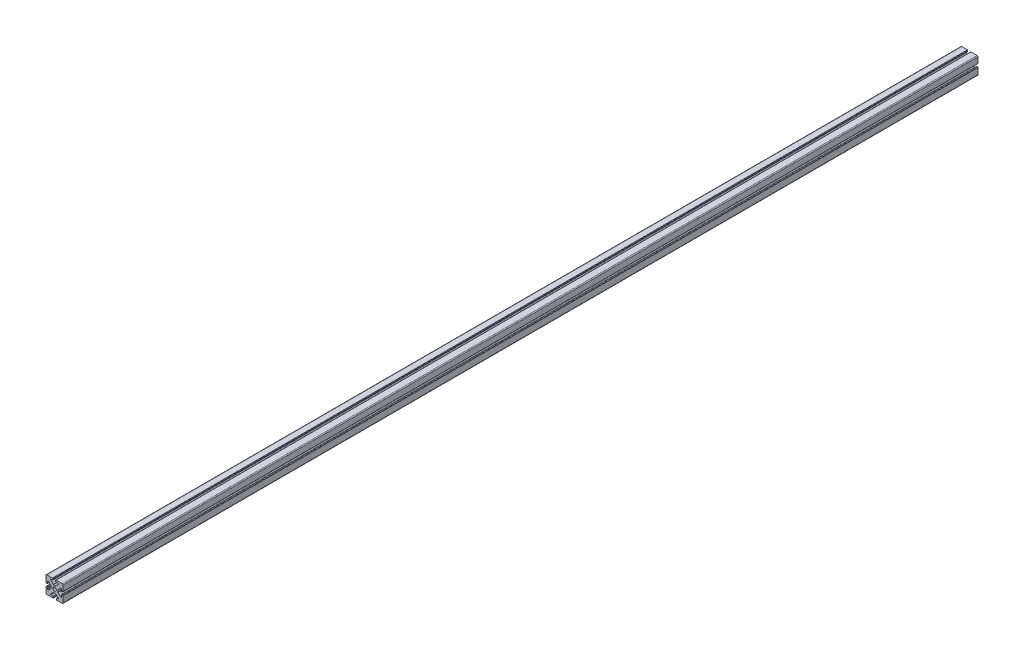
from build123d import *

# Parameters (mm, degrees)
SKETCH_1_W               = 40
SKETCH_1_H               = 40
EXTRUDE_1_DEPTH          = 2140
SKETCH_2_R               = 4.05
CUT_EXTRUDE_1_DEPTH      = 10000
CUT_EXTRUDE_2_DEPTH      = 10000
FILLET_1_R               = 1
PATTERN_CIRCULAR_2_COUNT = 4
FILLET_2_R               = 1
FILLET_3_R               = 1
FILLET_4_R               = 1
FILLET_5_R               = 2


with BuildPart() as part:
    # 草图1 → 凸台-拉伸1 (new body)
    with BuildSketch(Plane.XY):
        Rectangle(SKETCH_1_W, SKETCH_1_H)
    extrude(amount=EXTRUDE_1_DEPTH)

    # 草图2 → 切除-拉伸1 (cut)
    with BuildSketch(Plane.XY.offset(2140)):
        Circle(SKETCH_2_R)
    extrude(amount=-CUT_EXTRUDE_1_DEPTH, mode=Mode.SUBTRACT)

    # 草图4 → 切除-拉伸2 (cut)
    with BuildSketch(Plane.XY.offset(2140)):
        Polygon((20, 0), (20, 4), (16, 4), (16, 10.5), (7.876860985, 2.6), (7.876860985, -2.6), (16, -10.5), (16, -2.65197969), (20, -2.65197969), align=None)
    cut_extrude_2 = extrude(amount=-CUT_EXTRUDE_2_DEPTH, mode=Mode.SUBTRACT)

    # 圆角1
    fillet_1_edges = [part.edges().sort_by_distance(p)[0] for p in [
        (20, -2.65197969, 1070),
        (16, -2.65197969, 1070),
        (16, -10.5, 1070),
        (7.876860985, -2.6, 1070),
        (7.876860985, 2.6, 1070),
        (16, 10.5, 1070),
        (16, 4, 1070),
        (20, 4, 1070),
    ]]
    fillet(fillet_1_edges, radius=FILLET_1_R)

    # 阵列(圆周)2: 切除-拉伸2 ×4 about axis
    pattern_circular_2_axis = Axis((0, 0, 0), (0, 0, 1))
    for i in range(1, PATTERN_CIRCULAR_2_COUNT):
        add(cut_extrude_2.rotate(pattern_circular_2_axis, i * 360 / PATTERN_CIRCULAR_2_COUNT), mode=Mode.SUBTRACT)

    # 圆角2
    fillet_2_edges = [part.edges().sort_by_distance(p)[0] for p in [
        (2.65197969, 20, 1070),
        (2.65197969, 16, 1070),
        (10.5, 16, 1070),
        (2.6, 7.876860985, 1070),
        (-2.6, 7.876860985, 1070),
        (-10.5, 16, 1070),
        (-4, 16, 1070),
        (-4, 20, 1070),
    ]]
    fillet(fillet_2_edges, radius=FILLET_2_R)

    # 圆角3
    fillet_3_edges = [part.edges().sort_by_distance(p)[0] for p in [
        (-20, 2.65197969, 1070),
        (-16, 2.65197969, 1070),
        (-16, 10.5, 1070),
        (-7.876860985, 2.6, 1070),
        (-7.876860985, -2.6, 1070),
        (-16, -10.5, 1070),
        (-16, -4, 1070),
        (-20, -4, 1070),
    ]]
    fillet(fillet_3_edges, radius=FILLET_3_R)

    # 圆角4
    fillet_4_edges = [part.edges().sort_by_distance(p)[0] for p in [
        (-2.65197969, -20, 1070),
        (-2.65197969, -16, 1070),
        (-10.5, -16, 1070),
        (-2.6, -7.876860985, 1070),
        (2.6, -7.876860985, 1070),
        (10.5, -16, 1070),
        (4, -16, 1070),
        (4, -20, 1070),
    ]]
    fillet(fillet_4_edges, radius=FILLET_4_R)

    # 圆角5
    fillet_5_edges = [part.edges().sort_by_distance(p)[0] for p in [
        (20, -20, 1070),
        (-20, -20, 1070),
        (-20, 20, 1070),
        (20, 20, 1070),
    ]]
    fillet(fillet_5_edges, radius=FILLET_5_R)


solid = part.part
